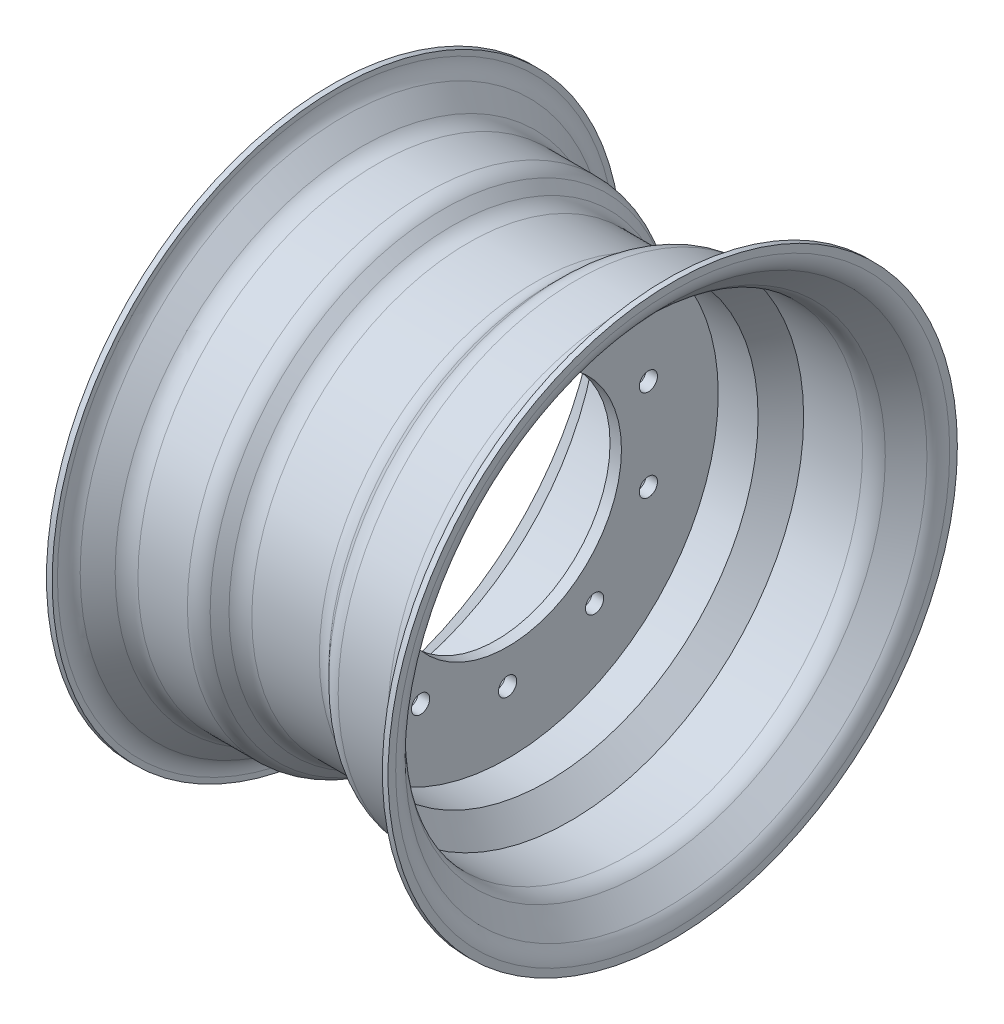
from build123d import *

# Parameters (mm, degrees)
FILLET1_R          = 20
SKETCH2_R          = 8
CUT_EXTRUDE1_DEPTH = 10
CIRPATTERN1_COUNT  = 10


with BuildPart() as part:
    # Sketch1 → Revolve1 (revolve)
    with BuildSketch(Plane.XY, mode=Mode.PRIVATE) as revolve1_sk:
        Polygon((-150, 250), (-150, 235), (-120, 205), (-60, 205), (-40, 185), (-5, 185), (-5, 100), (5, 100), (5, 185), (40, 185), (60, 205), (120, 205), (150, 235), (150, 250), (145, 250), (145, 237.071067812), (117.928932188, 210), (57.928932188, 210), (37.928932188, 190), (-37.928932188, 190), (-57.928932188, 210), (-117.928932188, 210), (-145, 237.071067812), (-145, 250), align=None)
    revolve(revolve1_sk.sketch.rotate(Axis((0, 0, 0), (-1, 0, 0)), 90), axis=Axis((0, 0, 0), (-1, 0, 0)))

    # Fillet1
    fillet1_edges = [part.edges().sort_by_distance(p)[0] for p in [
        (120, 0, 205),
        (150, 0, 235),
        (117.928932188, 0, 210),
        (57.928932188, 0, 210),
        (37.928932188, 0, 190),
        (-37.928932188, 0, 190),
        (-57.928932188, 0, 210),
        (-117.928932188, 0, 210),
        (-145, 0, 237.071067812),
    ]]
    fillet(fillet1_edges, radius=FILLET1_R)

    # Sketch2 → Cut-Extrude1 (cut)
    with BuildSketch(Plane(origin=(5, 0, 0), x_dir=(0, 0, -1), z_dir=(1, 0, 0))):
        with Locations((0, 130)):
            Circle(SKETCH2_R)
    cut_extrude1 = extrude(amount=-CUT_EXTRUDE1_DEPTH, mode=Mode.SUBTRACT)

    # CirPattern1: Cut-Extrude1 ×10 about axis
    cirpattern1_axis = Axis((0, 0, 0), (1, 0, 0))
    for i in range(1, CIRPATTERN1_COUNT):
        add(cut_extrude1.rotate(cirpattern1_axis, i * 360 / CIRPATTERN1_COUNT), mode=Mode.SUBTRACT)


solid = part.part
